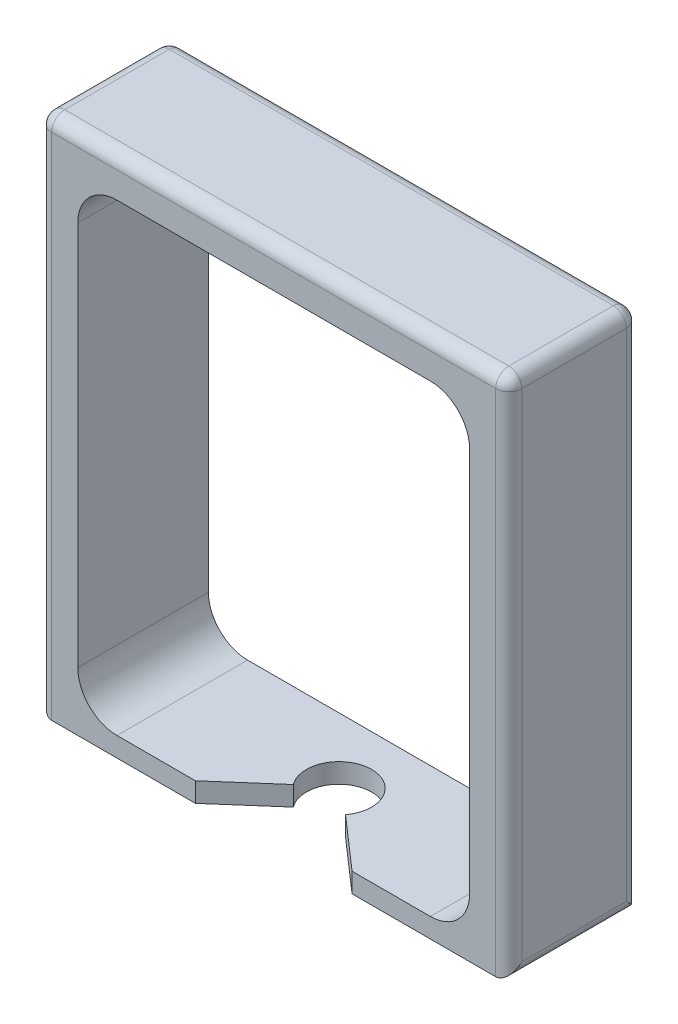
from build123d import *

# Parameters (mm, degrees)
SKETCH1_W           = 36
SKETCH1_H           = 40
SKETCH1_W_2         = 30
SKETCH1_H_2         = 35.5
BOSS_EXTRUDE1_DEPTH = 10
CUT_EXTRUDE2_REACH  = 46.989
FILLET1_R           = 3
FILLET2_R           = 1


with BuildPart() as part:
    # Sketch1 → Boss-Extrude1 (new body)
    with BuildSketch(Plane.XY):
        Rectangle(SKETCH1_W, SKETCH1_H)
        with Locations((0, -0.75)):
            Rectangle(SKETCH1_W_2, SKETCH1_H_2, mode=Mode.SUBTRACT)
    extrude(amount=BOSS_EXTRUDE1_DEPTH)

    # Sketch2 → Cut-Extrude2 (cut, up to next)
    with BuildSketch(Plane.XZ.offset(20), mode=Mode.PRIVATE) as cut_extrude2_sk1:
        with BuildLine():
            Line((-6, 10), (-2, 6.5))
            ThreePointArc((-2, 6.5), (0, 2.5), (2, 6.5))
            Line((2, 6.5), (6, 10))
            Line((6, 10), (-6, 10))
        make_face()
    cut_extrude2_tool1 = extrude(cut_extrude2_sk1.sketch, amount=-CUT_EXTRUDE2_REACH, mode=Mode.PRIVATE) & part.part
    add(cut_extrude2_tool1.solids().sort_by_distance((0, -20, 7.092656))[0], mode=Mode.SUBTRACT)

    # Fillet1
    fillet1_edges = [part.edges().sort_by_distance(p)[0] for p in [
        (-15, 17, 5),
        (-15, -18.5, 5),
        (15, -18.5, 5),
        (15, 17, 5),
    ]]
    fillet(fillet1_edges, radius=FILLET1_R)

    # Fillet2
    fillet2_edges = [part.edges().sort_by_distance(p)[0] for p in [
        (18, 0, 10),
        (0, 20, 10),
        (-18, 0, 10),
        (0, 20, 0),
        (18, 0, 0),
        (-18, 0, 0),
        (-18, 20, 5),
        (18, 20, 5),
        (18, -20, 5),
        (-18, -20, 5),
    ]]
    fillet(fillet2_edges, radius=FILLET2_R)


solid = part.part
